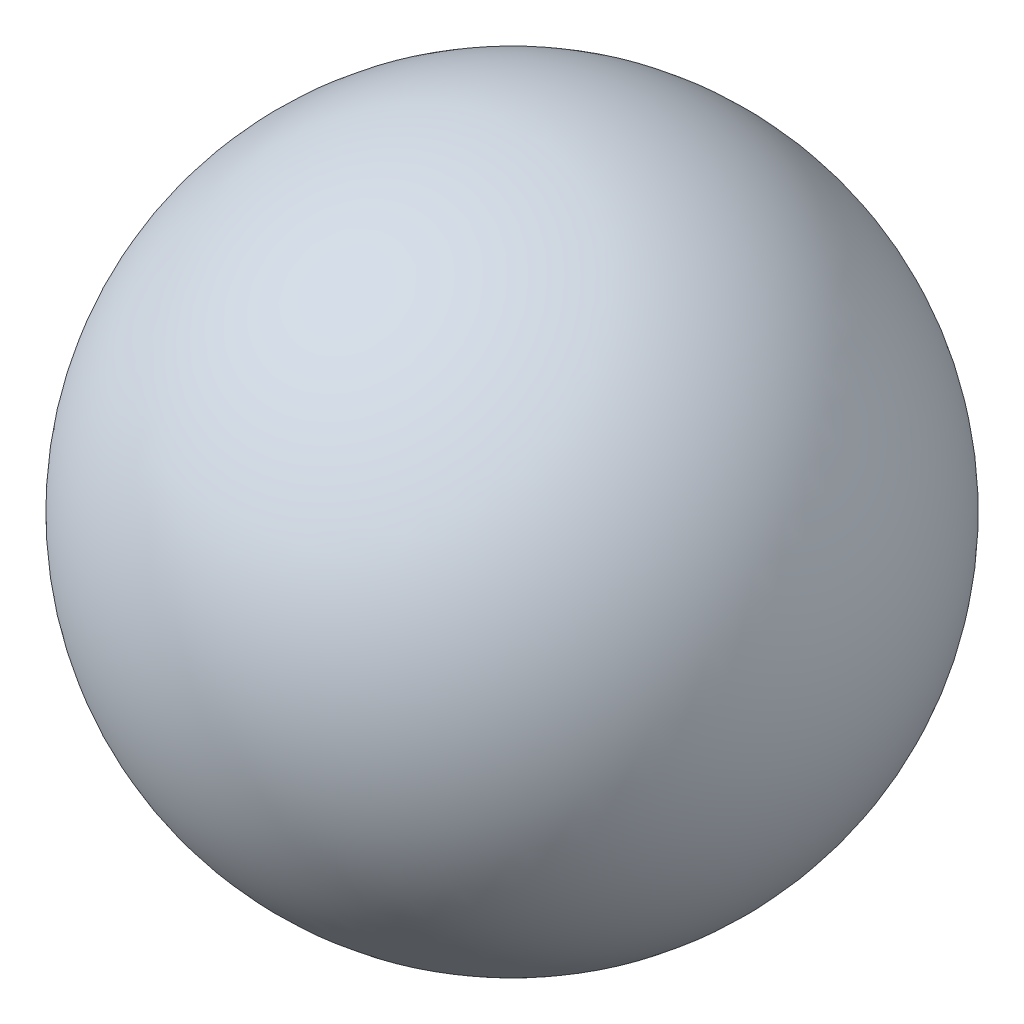
from build123d import *


with BuildPart() as part:
    # Esquisse1 → Révolution1 (revolve)
    with BuildSketch(Plane.XY):
        with BuildLine():
            Line((0, 2.75), (0, -2.75))
            ThreePointArc((0, -2.75), (2.75, 0), (0, 2.75))
        make_face()
    revolve(axis=Axis((0, 2.75, 0), (0, -1, 0)))


solid = part.part
